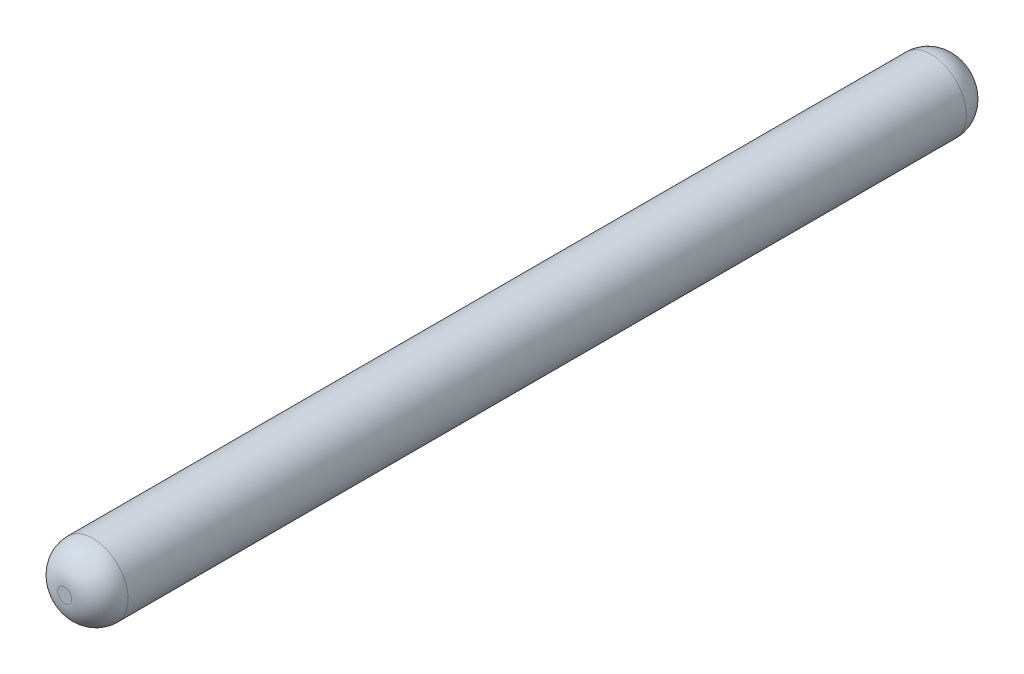
from build123d import *

# Parameters (mm, degrees)
CROQUIS1_R              = 0.5
SALIENTE_EXTRUIR1_DEPTH = 12.7
REDONDEO6_R             = 0.4


with BuildPart() as part:
    # Croquis1 → Saliente-Extruir1 (new body)
    with BuildSketch(Plane.XY):
        Circle(CROQUIS1_R)
    extrude(amount=SALIENTE_EXTRUIR1_DEPTH)

    # Redondeo6
    redondeo6_edges = [part.edges().sort_by_distance(p)[0] for p in [
        (-0.5, 0, 0),
        (-0.5, 0, 12.7),
    ]]
    fillet(redondeo6_edges, radius=REDONDEO6_R)


solid = part.part
